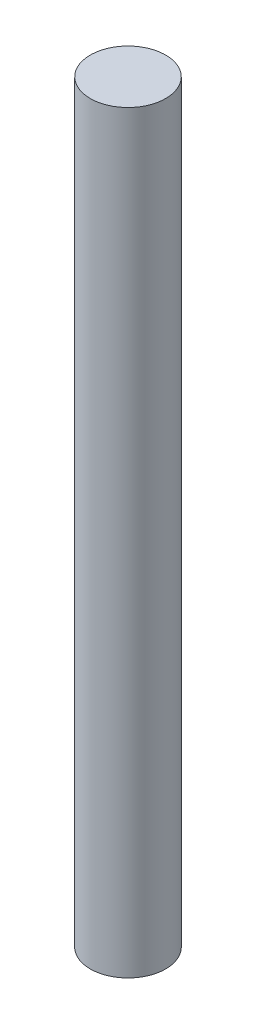
from build123d import *

# Parameters (mm, degrees)
SKETCH2_R           = 10
BOSS_EXTRUDE2_DEPTH = 200


with BuildPart() as part:
    # Sketch2 → Boss-Extrude2 (new body)
    with BuildSketch(Plane(origin=(0, 0, 0), x_dir=(1, 0, 0), z_dir=(0, 1, 0))):
        with Locations(Location((0, 0, 0), (0, 0, 270))):
            Circle(SKETCH2_R)
    extrude(amount=BOSS_EXTRUDE2_DEPTH)


solid = part.part
